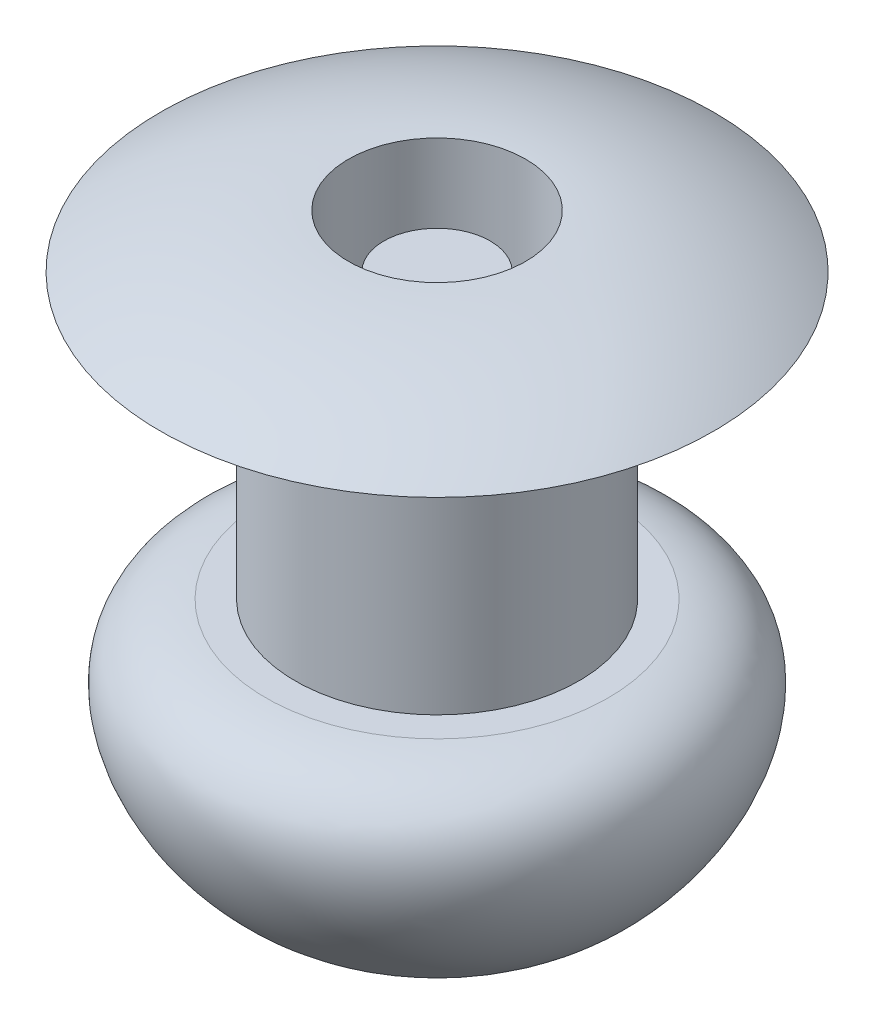
from build123d import *


with BuildPart() as part:
    # Szkic1 → Obrót1 (revolve)
    with BuildSketch(Plane(origin=(0, 0, 0), x_dir=(0, 0, -1), z_dir=(1, 0, 0)), mode=Mode.PRIVATE) as obr_t1_sk:
        with BuildLine():
            Line((0, 0), (0, -4.121746268))
            Line((0, -4.121746268), (0, -4.200738523))
            Line((0, -4.200738523), (0, -5.700738523))
            add(Edge.make_bspline(
                [(-0.956030427, -5.578929194), (-0.520263876, -5.700738523), (0, -5.700738523)],
                knots=[0.992852221, 0.992852221, 0.992852221, 1.570796327, 1.570796327, 1.570796327], degree=2, weights=[1, 0.958537313, 1]))
            add(Edge.make_bspline(
                [(-2.413891755, -4), (-3.867503112, -4.169657322), (-3.528877649, -6.302013626), (-1.083961642, -7.873532369), (-0.271752618, -5.874949298), (-0.956030427, -5.578929194)],
                knots=[0, 0, 0, 0, 0.464993082, 0.721927553, 1, 1, 1, 1], degree=3))
            Line((-2.413891755, -4), (-2, -4))
            Line((-2, -4), (-2, 0))
            Line((-2, 0), (-3.9, 0))
            ThreePointArc((-3.9, 0), (-2.627043935, 0.558888572), (-1.25, 0.75))
            Line((-1.25, 0.75), (-1.25, -4.200738523))
            Line((-1.25, -4.200738523), (-0.75, -4.200738523))
            Line((-0.75, -4.200738523), (-0.75, 0))
            Line((-0.75, 0), (0, 0))
        make_face()
    revolve(obr_t1_sk.sketch.rotate(Axis((0, 0, 0), (0, 1, 0)), 180), axis=Axis((0, 0, 0), (0, 1, 0)))


solid = part.part
